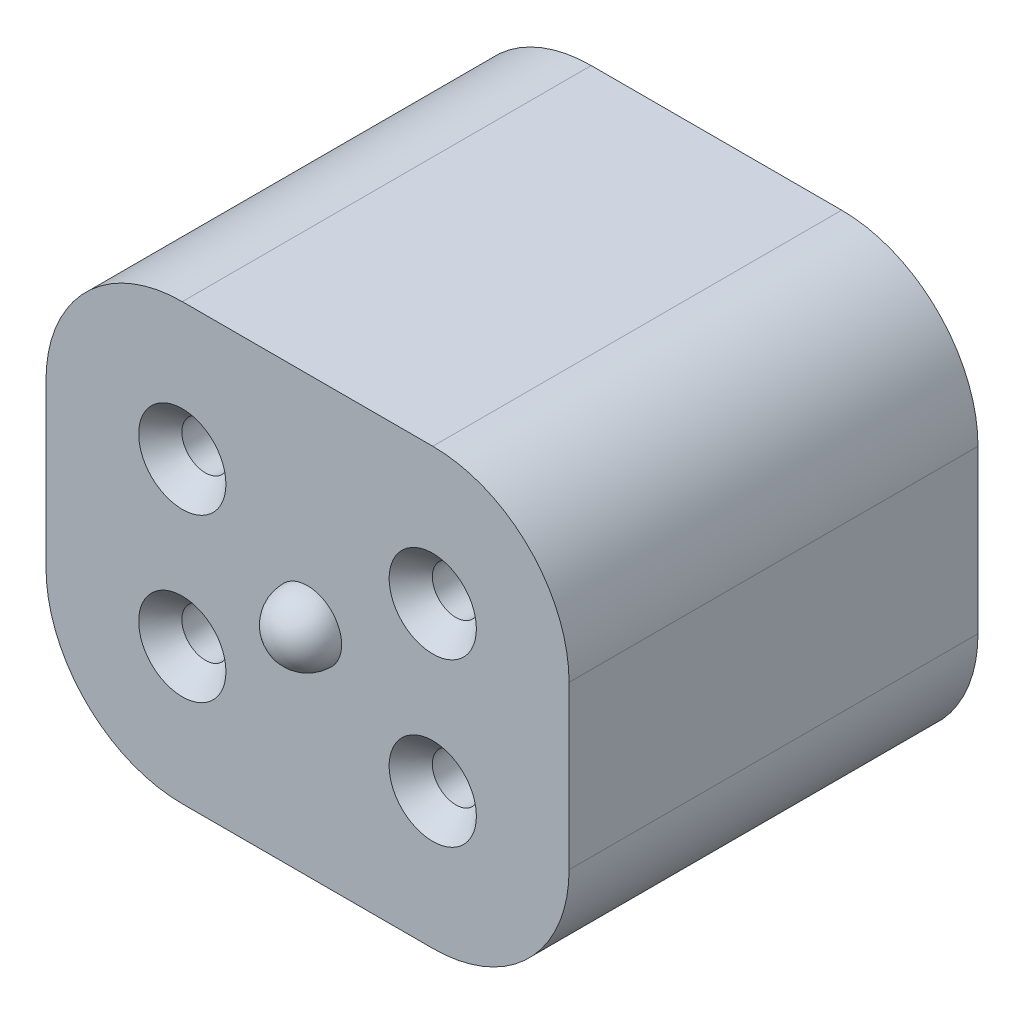
from build123d import *

# Parameters (mm, degrees)
ESBO_O1_R                                            = 1.6
RESSALTO_EXTRUS_O1_DEPTH                             = 30
ESCAREADO_PARA_PARAFUSO_DE_M_QUINA_COM_C_D           = 3.4544
ESCAREADO_PARA_PARAFUSO_DE_M_QUINA_COM_C_CSINK_D     = 6.4008
ESCAREADO_PARA_PARAFUSO_DE_M_QUINA_COM_C_CSINK_ANGLE = 82
CORTE_EXTRUS_O3_DEPTH                                = 10
ESBO_O28_R                                           = 2.758385
CORTE_EXTRUS_O8_DEPTH                                = 10


with BuildPart() as part:
    # Esboço1 → Ressalto-extrusão1 (new body)
    with BuildSketch(Plane.XY):
        with BuildLine():
            Line((0, -10), (0, -21.90721))
            ThreePointArc((0, -21.90721), (2.928932, -28.978277), (10, -31.90721))
            Line((10, -31.90721), (28.375876, -31.90721))
            ThreePointArc((28.375876, -31.90721), (35.446943, -28.978277), (38.375876, -21.90721))
            Line((38.375876, -21.90721), (38.375876, -10))
            ThreePointArc((38.375876, -10), (35.446943, -2.928932), (28.375876, 0))
            Line((28.375876, 0), (10, 0))
            ThreePointArc((10, 0), (2.928932, -2.928932), (0, -10))
        make_face()
        with Locations((28.375876, -10)):
            Circle(ESBO_O1_R, mode=Mode.SUBTRACT)
        with Locations((10, -10)):
            Circle(ESBO_O1_R, mode=Mode.SUBTRACT)
        with Locations((10, -21.90721)):
            Circle(ESBO_O1_R, mode=Mode.SUBTRACT)
        with Locations((28.375876, -21.90721)):
            Circle(ESBO_O1_R, mode=Mode.SUBTRACT)
    extrude(amount=RESSALTO_EXTRUS_O1_DEPTH)

    # Escareado para parafuso de máquina com cabeça oval de #52 (through all)
    with Locations(Plane.XY.offset(30)):
        with Locations((10, -10), (28.375876, -10), (28.375876, -21.90721), (10, -21.90721)):
            CounterSinkHole(ESCAREADO_PARA_PARAFUSO_DE_M_QUINA_COM_C_D / 2, ESCAREADO_PARA_PARAFUSO_DE_M_QUINA_COM_C_CSINK_D / 2, counter_sink_angle=ESCAREADO_PARA_PARAFUSO_DE_M_QUINA_COM_C_CSINK_ANGLE)

    # Esboço23 → Corte-extrusão3 (cut)
    with BuildSketch(Plane(origin=(0, 0, 0), x_dir=(-1, 0, 0), z_dir=(0, 0, -1))):
        Polygon((-19.187938, -15.953605), (-28.375876, -10), (-28.375876, -21.90721), align=None)
        with BuildLine():
            ThreePointArc((-19.183742, -15.950886), (-19.182938, -15.953605), (-19.183742, -15.956324))
            Line((-19.183742, -15.956324), (-10, -21.90721))
            Line((-10, -21.90721), (-10, -10))
            Line((-10, -10), (-19.183742, -15.950886))
        make_face()
    extrude(amount=-CORTE_EXTRUS_O3_DEPTH, mode=Mode.SUBTRACT)

    # Esboço28 → Corte-extrusão8 (cut)
    with BuildSketch(Plane(origin=(0, 0, 0), x_dir=(-1, 0, 0), z_dir=(0, 0, -1))):
        with Locations((-19.183742, -15.956324)):
            Circle(ESBO_O28_R)
    extrude(amount=-CORTE_EXTRUS_O8_DEPTH, mode=Mode.SUBTRACT)

    # Esboço29 → bola (revolve)
    with BuildSketch(Plane.XY.offset(30)):
        with BuildLine():
            ThreePointArc((21.285981, -14.594114), (17.828447, -13.855562), (17.089895, -17.313096))
            Line((17.089895, -17.313096), (21.285981, -14.594114))
        make_face()
        with BuildLine():
            Line((21.285981, -14.594114), (17.089895, -17.313096))
            ThreePointArc((17.089895, -17.313096), (19.896772, -18.35101), (21.687938, -15.953605))
            ThreePointArc((21.687938, -15.953605), (21.585343, -15.24477), (21.285981, -14.594114))
        make_face()
    revolve(axis=Axis((10, -21.90721, 30), (0.8392171833395659, 0.5437963949748155, 0)))


solid = part.part
